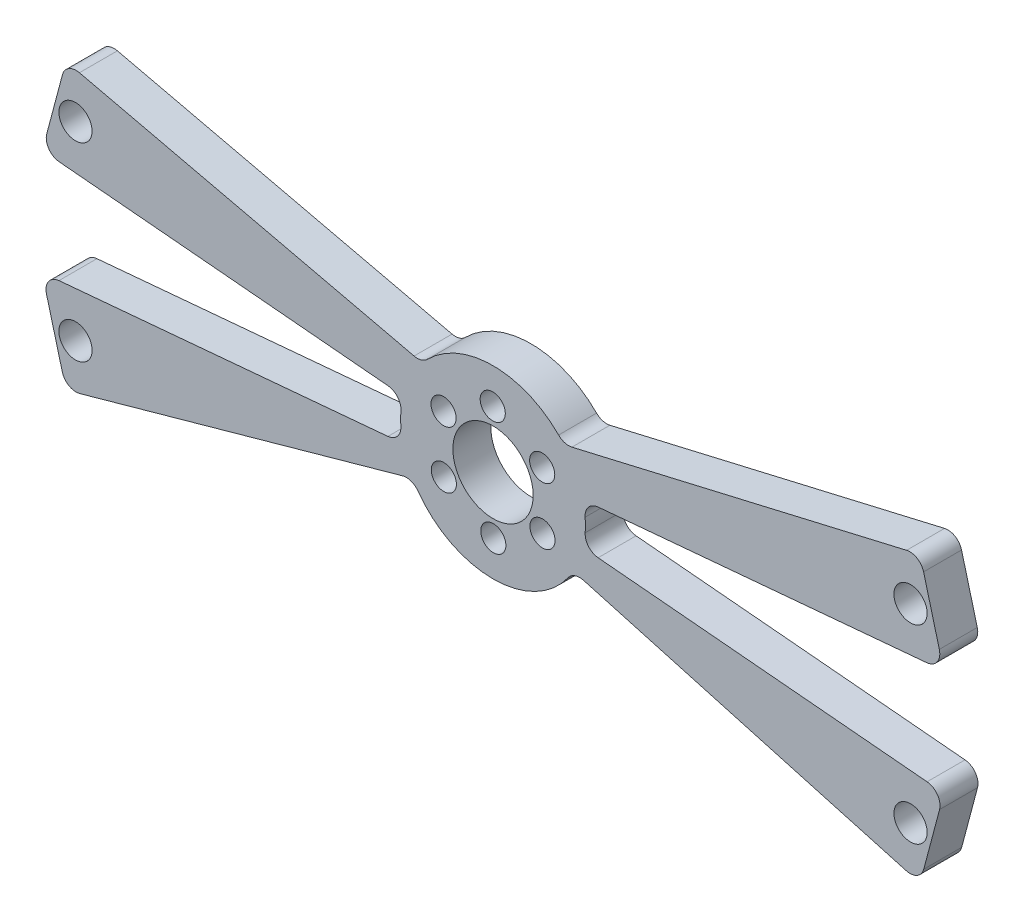
from build123d import *

# Parameters (mm, degrees)
EXTRUDE_2_DEPTH     = 8
SKETCH_4_R          = 3.5
SKETCH_4_R_2        = 8.462893534
CUT_EXTRUDE_1_DEPTH = 126.60827275


with BuildPart() as part:
    # 草图1 → 凸台-拉伸2 (new body)
    with BuildSketch(Plane.XY):
        with BuildLine():
            ThreePointArc((-44.271832455, 12.900159535), (-42.760990151, 12.93891125), (-41.460762065, 13.709335217))
            ThreePointArc((-41.460762065, 13.709335217), (-27.63735599, 19.468755163), (-13.813949915, 13.709335217))
            ThreePointArc((-13.813949915, 13.709335217), (-12.513721829, 12.93891125), (-11.002879525, 12.900159535))
            Line((-11.002879525, 12.900159535), (59.529347881, 29.339622898))
            ThreePointArc((59.529347881, 29.339622898), (61.75543851, 28.989437599), (63.109724345, 27.188321525))
            Line((63.109724345, 27.188321525), (66.427142402, 14.703033787))
            ThreePointArc((66.427142402, 14.703033787), (65.985368626, 12.212155416), (63.796050229, 10.944668104))
            Line((63.796050229, 10.944668104), (-5.503908774, 4.721894109))
            ThreePointArc((-5.503908774, 4.721894109), (-7.526265644, 3.671148438), (-8.226657796, 1.502405805))
            ThreePointArc((-8.226657796, 1.502405805), (-8.168778443, 0.083161809), (-8.214531044, -1.33652486))
            ThreePointArc((-8.214531044, -1.33652486), (-7.503974356, -3.489473399), (-5.489913373, -4.530452062))
            Line((-5.489913373, -4.530452062), (63.846058336, -10.75645981))
            ThreePointArc((63.846058336, -10.75645981), (66.035376732, -12.023947122), (66.477150508, -14.514825493))
            Line((66.477150508, -14.514825493), (63.142843844, -27.063674443))
            ThreePointArc((63.142843844, -27.063674443), (61.732433193, -28.897690671), (59.436427456, -29.182701869))
            Line((59.436427456, -29.182701869), (-8.561409136, -10.190770239))
            ThreePointArc((-8.561409136, -10.190770239), (-10.364737659, -10.250456004), (-11.807672821, -11.33373541))
            ThreePointArc((-11.807672821, -11.33373541), (-27.63735599, -19.468755163), (-43.467039159, -11.33373541))
            ThreePointArc((-43.467039159, -11.33373541), (-44.909974321, -10.250456004), (-46.713302844, -10.190770239))
            Line((-46.713302844, -10.190770239), (-114.711139436, -29.182701869))
            ThreePointArc((-114.711139436, -29.182701869), (-117.007145173, -28.897690671), (-118.417555824, -27.063674443))
            Line((-118.417555824, -27.063674443), (-121.751862488, -14.514825493))
            ThreePointArc((-121.751862488, -14.514825493), (-121.310088712, -12.023947122), (-119.120770315, -10.75645981))
            Line((-119.120770315, -10.75645981), (-49.784798606, -4.530452062))
            ThreePointArc((-49.784798606, -4.530452062), (-47.770737623, -3.489473399), (-47.060180936, -1.33652486))
            ThreePointArc((-47.060180936, -1.33652486), (-47.105933537, 0.083161809), (-47.048054184, 1.502405805))
            ThreePointArc((-47.048054184, 1.502405805), (-47.748446336, 3.671148438), (-49.770803206, 4.721894109))
            Line((-49.770803206, 4.721894109), (-119.070762209, 10.944668104))
            ThreePointArc((-119.070762209, 10.944668104), (-121.260080606, 12.212155416), (-121.701854382, 14.703033787))
            Line((-121.701854382, 14.703033787), (-118.384436325, 27.188321525))
            ThreePointArc((-118.384436325, 27.188321525), (-117.03015049, 28.989437599), (-114.804059861, 29.339622898))
            Line((-114.804059861, 29.339622898), (-44.271832455, 12.900159535))
        make_face()
    extrude(amount=EXTRUDE_2_DEPTH)

    # 草图4 → 切除-拉伸1 (cut, through all)
    with BuildSketch(Plane.XY.offset(8)):
        with Locations((-115.63735599, -20)):
            Circle(SKETCH_4_R)
        with Locations((-115.63735599, 20)):
            Circle(SKETCH_4_R)
        with Locations((60.36264401, -20)):
            Circle(SKETCH_4_R)
        with Locations((60.36264401, 20)):
            Circle(SKETCH_4_R)
        with Locations((-27.63735599, 0)):
            Circle(SKETCH_4_R_2)
        with BuildLine():
            ThreePointArc((-37.984908909, -8.703484854), (-35.348611937, -6.039852319), (-38.012244471, -3.403555348))
            ThreePointArc((-38.012244471, -3.403555348), (-40.648541443, -6.067187882), (-37.984908909, -8.703484854))
        make_face()
        with BuildLine():
            ThreePointArc((-25.273693465, -13.312986121), (-26.26231842, -9.698069705), (-29.877234836, -10.68669466))
            ThreePointArc((-29.877234836, -10.68669466), (-28.888609881, -14.301611076), (-25.273693465, -13.312986121))
        make_face()
        with BuildLine():
            ThreePointArc((-19.502346355, -7.283139312), (-15.877424428, -8.234423195), (-14.926140546, -4.609501268))
            ThreePointArc((-14.926140546, -4.609501268), (-18.551062473, -3.658217385), (-19.502346355, -7.283139312))
        make_face()
        with BuildLine():
            ThreePointArc((-17.262467509, 3.403555348), (-14.626170537, 6.067187882), (-17.289803071, 8.703484854))
            ThreePointArc((-17.289803071, 8.703484854), (-19.926100043, 6.039852319), (-17.262467509, 3.403555348))
        make_face()
        with BuildLine():
            ThreePointArc((-25.397477144, 10.68669466), (-26.386102099, 14.301611076), (-30.001018515, 13.312986121))
            ThreePointArc((-30.001018515, 13.312986121), (-29.01239356, 9.698069705), (-25.397477144, 10.68669466))
        make_face()
        with BuildLine():
            ThreePointArc((-35.772365625, 7.283139312), (-39.397287552, 8.234423195), (-40.348571434, 4.609501268))
            ThreePointArc((-40.348571434, 4.609501268), (-36.723649507, 3.658217385), (-35.772365625, 7.283139312))
        make_face()
    extrude(amount=-CUT_EXTRUDE_1_DEPTH, mode=Mode.SUBTRACT)


solid = part.part
